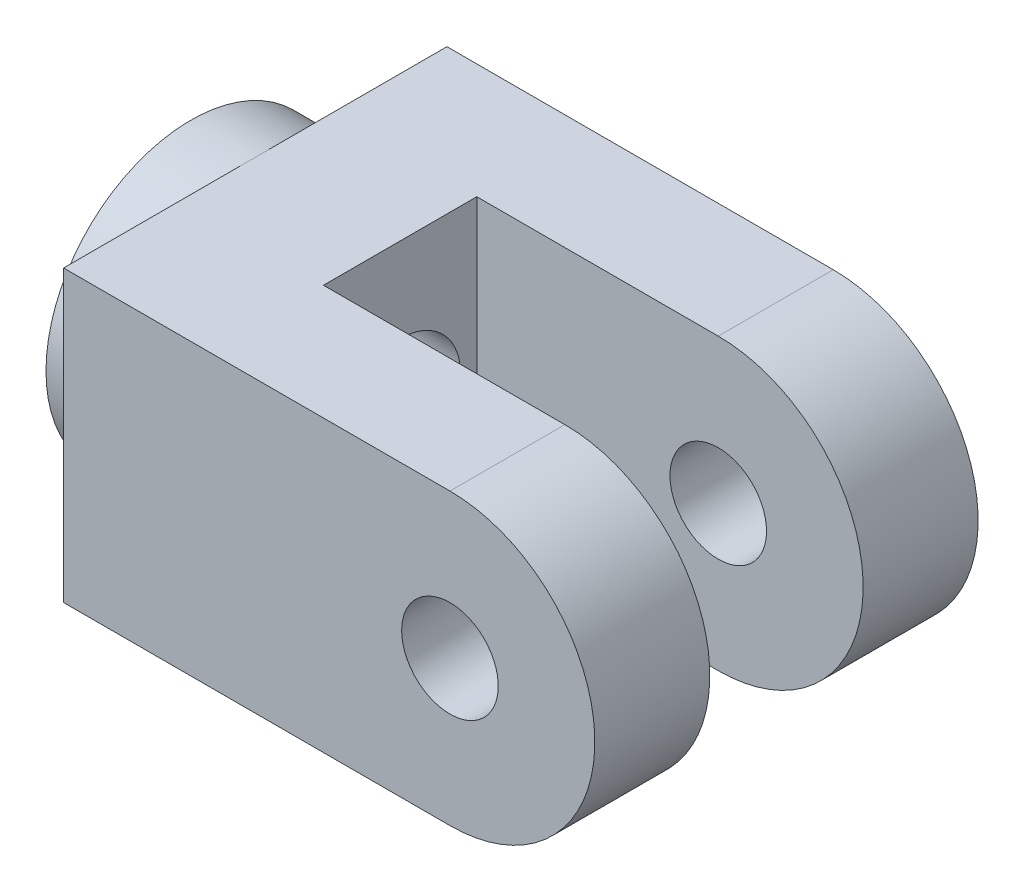
from build123d import *

# Parameters (mm, degrees)
SKETCH1_W               = 132
SKETCH1_H               = 72
BOSS_EXTRUDE1_DEPTH     = 47.625
CUT_EXTRUDE1_DEPTH      = 122.344808294
CUT_EXTRUDE1_DEPTH_BACK = 122.344808294
SKETCH3_W               = 60
SKETCH3_H               = 38.1
SKETCH3_W_2             = 36
CUT_EXTRUDE2_DEPTH      = 109.665268715
SKETCH4_R               = 15
CUT_EXTRUDE3_DEPTH      = 145.872842952
BOSS_EXTRUDE6_START     = 16
SKETCH5_R               = 36
SKETCH5_R_2             = 15
BOSS_EXTRUDE6_DEPTH     = 16
SKETCH6_R               = 12
CUT_EXTRUDE4_DEPTH      = 131.738527221


with BuildPart() as part:
    # Sketch1 → Boss-Extrude1 (new, symmetric)
    with BuildSketch(Plane.XY):
        Rectangle(SKETCH1_W, SKETCH1_H)
    extrude(amount=BOSS_EXTRUDE1_DEPTH, both=True)

    # Sketch2 → Cut-Extrude1 (cut, two sides: drawn at the far end of the back side and taken through both)
    with BuildSketch(Plane(origin=(0, 0, -47.625), x_dir=(-1, 0, 0), z_dir=(0, 0, -1)).offset(-CUT_EXTRUDE1_DEPTH_BACK)):
        with BuildLine():
            Line((220.00000377, 36), (-30, 36))
            ThreePointArc((-30, 36), (-66, 1.178e-06), (-30.000002356, -36))
            Line((-30.000002356, -36), (220.000001414, -36.000016362))
            Line((220.000001414, -36.000016362), (-280.000006126, -36))
            Line((-280.000006126, -36), (-280.00000377, 36.000016362))
            Line((-280.00000377, 36.000016362), (220.00000377, 36))
        make_face()
    extrude(amount=CUT_EXTRUDE1_DEPTH + CUT_EXTRUDE1_DEPTH_BACK, mode=Mode.SUBTRACT)

    # Sketch3 → Cut-Extrude2 (cut, through all)
    with BuildSketch(Plane(origin=(0, 36, 0), x_dir=(1, 0, 0), z_dir=(0, 1, 0))):
        with Locations((0, -0.005)):
            Rectangle(SKETCH3_W, SKETCH3_H)
        with Locations((48, -0.005)):
            Rectangle(SKETCH3_W_2, SKETCH3_H)
    extrude(amount=-CUT_EXTRUDE2_DEPTH, mode=Mode.SUBTRACT)

    # Sketch4 → Cut-Extrude3 (cut, through all)
    with BuildSketch(Plane.ZY.offset(66)):
        Circle(SKETCH4_R)
    extrude(amount=-CUT_EXTRUDE3_DEPTH, mode=Mode.SUBTRACT)

    # Sketch5 → Boss-Extrude6 (add)
    with BuildSketch(Plane.ZY.offset(66).offset(BOSS_EXTRUDE6_START)):
        with Locations(Location((0, 0, 0), (0, 0, 270))):
            Circle(SKETCH5_R)
        Circle(SKETCH5_R_2, mode=Mode.SUBTRACT)
    extrude(amount=-BOSS_EXTRUDE6_DEPTH)

    # Sketch6 → Cut-Extrude4 (cut, through all)
    with BuildSketch(Plane(origin=(0, 0, -47.625), x_dir=(-1, 0, 0), z_dir=(0, 0, -1))):
        with Locations((-30, 0)):
            Circle(SKETCH6_R)
    extrude(amount=-CUT_EXTRUDE4_DEPTH, mode=Mode.SUBTRACT)


solid = part.part
